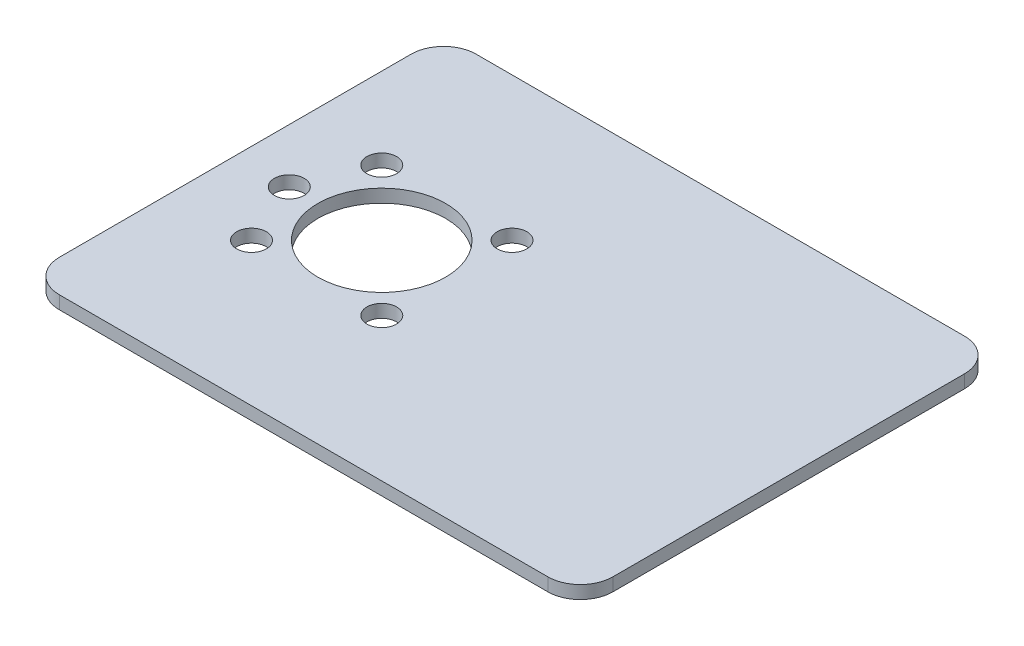
from build123d import *

# Parameters (mm, degrees)
SKETCH1_W                   = 107.95
SKETCH1_H                   = 81.28
BOSS_EXTRUDE1_DEPTH         = 2.54
M5_CLEARANCE_HOLE1_D        = 5.8
F_97_0_981_DIAMETER_HOLE1_D = 24.9174
FILLET1_R                   = 6.35


with BuildPart() as part:
    # Sketch1 → Boss-Extrude1 (new body)
    with BuildSketch(Plane(origin=(0, 0, 0), x_dir=(1, 0, 0), z_dir=(0, 1, 0))):
        with Locations((53.975, 40.64)):
            Rectangle(SKETCH1_W, SKETCH1_H)
    extrude(amount=BOSS_EXTRUDE1_DEPTH)

    # M5 Clearance Hole1 (through all)
    with Locations(Plane(origin=(0, 2.54, 0), x_dir=(1, 0, 0), z_dir=(0, 1, 0))):
        with Locations((15.875, 53.34), (41.275, 53.34), (41.275, 27.94), (15.875, 27.94), (10.541, 40.64)):
            Hole(M5_CLEARANCE_HOLE1_D / 2)

    # #97 (0.981) Diameter Hole1 (through all)
    with Locations(Plane(origin=(0, 2.54, 0), x_dir=(1, 0, 0), z_dir=(0, 1, 0))):
        with Locations((28.575, 40.64)):
            Hole(F_97_0_981_DIAMETER_HOLE1_D / 2)

    # Fillet1
    fillet1_edges = [part.edges().sort_by_distance(p)[0] for p in [
        (0, 1.27, -81.28),
        (107.95, 1.27, -81.28),
        (107.95, 1.27, 0),
        (0, 1.27, 0),
    ]]
    fillet(fillet1_edges, radius=FILLET1_R)


solid = part.part
